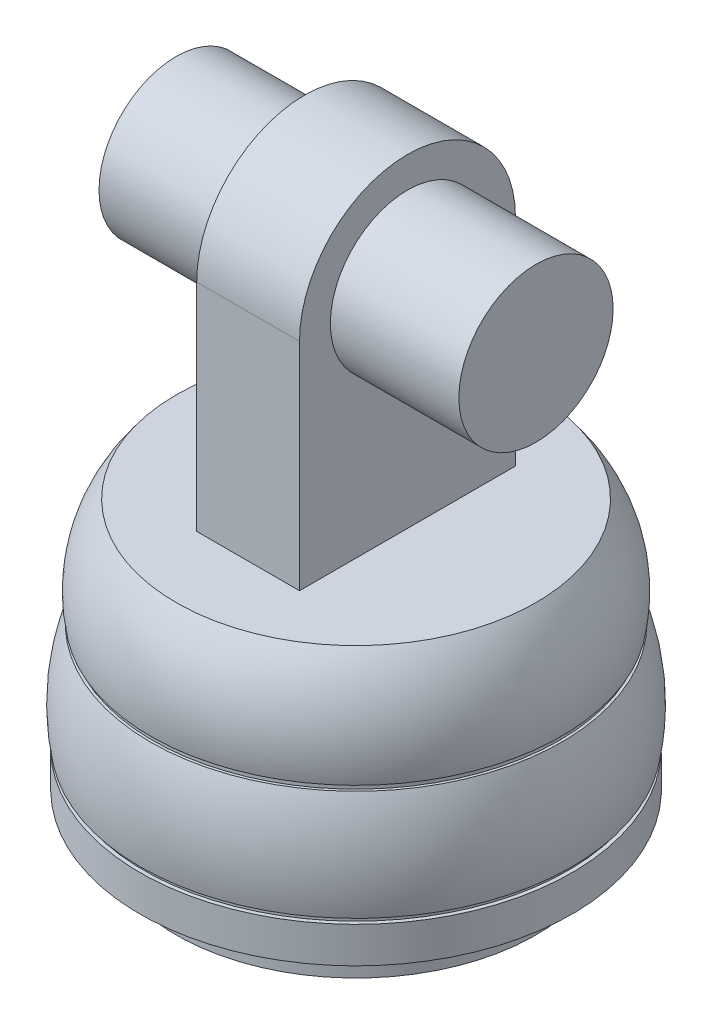
from build123d import *

# Parameters (mm, degrees)
SKETCH2_R            = 39.5
BOSS_EXTRUDE1_DEPTH  = 1
SKETCH4_R            = 41.25
BOSS_EXTRUDE2_DEPTH  = 1
SKETCH5_R            = 42
BOSS_EXTRUDE3_DEPTH  = 7
SKETCH6_R            = 35
BOSS_EXTRUDE4_DEPTH  = 7
BOSS_EXTRUDE5_DEPTH  = 1
CIRPATTERN1_COUNT    = 10
SKETCH9_R            = 15
BOSS_EXTRUDE6_DEPTH  = 10
SKETCH10_W           = 20
SKETCH10_H           = 42
BOSS_EXTRUDE7_DEPTH  = 42
BOSS_EXTRUDE8_START  = -20
BOSS_EXTRUDE8_DEPTH  = 20
SKETCH12_R           = 15
BOSS_EXTRUDE9_DEPTH  = 25
BOSS_EXTRUDE10_START = 25
SKETCH13_R           = 15
BOSS_EXTRUDE10_DEPTH = 25


with BuildPart() as part:
    # Sketch1 → Revolve1 (revolve)
    with BuildSketch(Plane.XY):
        with BuildLine():
            Line((-35, 0), (0, 0))
            Line((0, 0), (0, -20))
            Line((0, -20), (-40, -20))
            ThreePointArc((-40, -20), (-39.657515479, -9.46062113), (-35, 0))
        make_face()
    revolve(axis=Axis((0, 0, 0), (0, -1, 0)))

    # Sketch2 → Boss-Extrude1 (add)
    with BuildSketch(Plane.XZ.offset(20)):
        Circle(SKETCH2_R)
    extrude(amount=BOSS_EXTRUDE1_DEPTH)

    # Sketch3 → Revolve2 (revolve)
    with BuildSketch(Plane(origin=(0, 0, 0), x_dir=(0, 0, -1), z_dir=(1, 0, 0)), mode=Mode.PRIVATE) as revolve2_sk:
        with BuildLine():
            Line((0, -21), (-40, -21))
            ThreePointArc((-40, -21), (-42.384109041, -30.861589096), (-42, -41))
            Line((-42, -41), (0, -41))
            Line((0, -41), (0, -21))
        make_face()
    revolve(revolve2_sk.sketch.rotate(Axis((0, -21, 0), (0, -1, 0)), 90), axis=Axis((0, -21, 0), (0, -1, 0)))

    # Sketch4 → Boss-Extrude2 (add)
    with BuildSketch(Plane.XZ.offset(41)):
        with Locations(Location((0, 0, 0), (0, 0, 270))):
            Circle(SKETCH4_R)
    extrude(amount=BOSS_EXTRUDE2_DEPTH)

    # Sketch5 → Boss-Extrude3 (add)
    with BuildSketch(Plane.XZ.offset(42)):
        with Locations(Location((0, 0, 0), (0, 0, 270))):
            Circle(SKETCH5_R)
    extrude(amount=BOSS_EXTRUDE3_DEPTH)

    # Sketch6 → Boss-Extrude4 (add)
    with BuildSketch(Plane.XZ.offset(49)):
        with Locations(Location((0, 0, 0), (0, 0, 270))):
            Circle(SKETCH6_R)
    extrude(amount=BOSS_EXTRUDE4_DEPTH)

    # Sketch7 → Boss-Extrude5 (add)
    with BuildSketch(Plane.XZ.offset(49)):
        Polygon((38.446071931, -2.233948034), (40.380727679, -1.116974017), (40.380727679, 1.116974017), (38.446071931, 2.233948034), (36.511416183, 1.116974017), (36.511416183, -1.116974017), align=None)
        Polygon((38.446071931, -1.546904417), (39.785730453, -0.773452208), (39.785730453, 0.773452208), (38.446071931, 1.546904417), (37.106413409, 0.773452208), (37.106413409, -0.773452208), align=None, mode=Mode.SUBTRACT)
    boss_extrude5 = extrude(amount=BOSS_EXTRUDE5_DEPTH)

    # CirPattern1: Boss-Extrude5 ×10 about axis
    cirpattern1_axis = Axis((0, 0, 0), (0, 1, 0))
    for i in range(1, CIRPATTERN1_COUNT):
        add(boss_extrude5.rotate(cirpattern1_axis, i * 360 / CIRPATTERN1_COUNT))

    # Sketch9 → Boss-Extrude6 (add)
    with BuildSketch(Plane.XZ.offset(56)):
        with Locations(Location((0, 0, 0), (0, 0, 270))):
            Circle(SKETCH9_R)
    extrude(amount=BOSS_EXTRUDE6_DEPTH)

    # Sketch10 → Boss-Extrude7 (add)
    with BuildSketch(Plane(origin=(0, 0, 0), x_dir=(1, 0, 0), z_dir=(0, 1, 0))):
        Rectangle(SKETCH10_W, SKETCH10_H)
    extrude(amount=BOSS_EXTRUDE7_DEPTH)

    # Sketch11 → Boss-Extrude8 (add)
    with BuildSketch(Plane(origin=(10, 0, 0), x_dir=(0, 0, -1), z_dir=(1, 0, 0)).offset(BOSS_EXTRUDE8_START)):
        with BuildLine():
            Line((-21, 42), (21, 42))
            ThreePointArc((21, 42), (0, 63), (-21, 42))
        make_face()
    extrude(amount=BOSS_EXTRUDE8_DEPTH)

    # Sketch12 → Boss-Extrude9 (add)
    with BuildSketch(Plane.ZY.offset(10)):
        with Locations(Location((0, 42, 0), (0, 0, 180))):
            Circle(SKETCH12_R)
    extrude(amount=BOSS_EXTRUDE9_DEPTH)

    # Sketch13 → Boss-Extrude10 (add)
    with BuildSketch(Plane(origin=(10, 0, 0), x_dir=(0, 0, -1), z_dir=(1, 0, 0)).offset(BOSS_EXTRUDE10_START)):
        with Locations((0, 42)):
            Circle(SKETCH13_R)
    extrude(amount=-BOSS_EXTRUDE10_DEPTH)


solid = part.part
